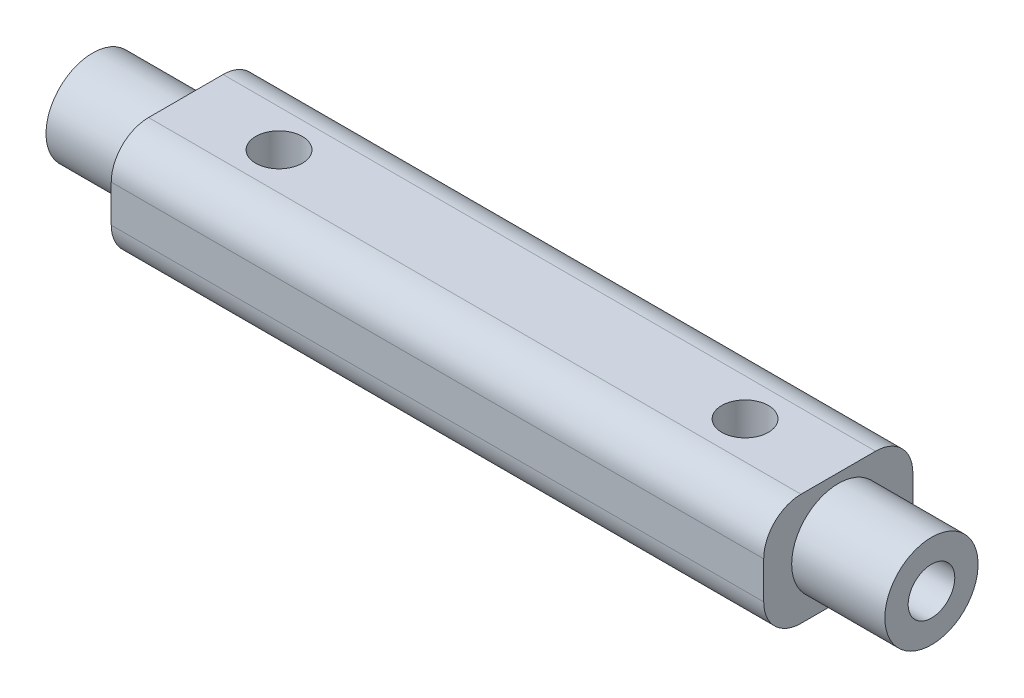
from build123d import *

# Parameters (mm, degrees)
SKETCH_1_W          = 8
SKETCH_1_H          = 6
EXTRUDE_1_DEPTH     = 17.5
SKETCH_2_R          = 2.5
EXTRUDE_2_DEPTH     = 22.5
FILLET_1_R          = 2
HOLE_WIZARD_M3_1_D  = 2.5
SKETCH_6_R          = 1
CUT_EXTRUDE_1_DEPTH = 24.627314701
HOLE_WIZARD_M3_2_D  = 2.5


with BuildPart() as part:
    # 草圖1 → 填料-伸長1 (new, symmetric)
    with BuildSketch(Plane(origin=(0, 0, 0), x_dir=(0, 0, -1), z_dir=(1, 0, 0))):
        Rectangle(SKETCH_1_W, SKETCH_1_H)
    extrude(amount=EXTRUDE_1_DEPTH, both=True)

    # 草圖2 → 填料-伸長2 (add, symmetric)
    with BuildSketch(Plane(origin=(0, 0, 0), x_dir=(0, 0, -1), z_dir=(1, 0, 0))):
        with Locations(Location((0, 0, 0), (0, 0, 180))):
            Circle(SKETCH_2_R)
    extrude(amount=EXTRUDE_2_DEPTH, both=True)

    # 圓角1
    fillet_1_edges = [part.edges().sort_by_distance(p)[0] for p in [
        (0, 3, 4),
        (0, 3, -4),
        (0, -3, -4),
        (0, -3, 4),
    ]]
    fillet(fillet_1_edges, radius=FILLET_1_R)

    # M3 螺紋孔1 (through all)
    with Locations(Plane(origin=(22.5, 0, 0), x_dir=(0, 0, -1), z_dir=(1, 0, 0))):
        with Locations((0, 0)):
            Hole(HOLE_WIZARD_M3_1_D / 2)

    # 草圖6 → 除料-伸長1 (cut, through all)
    with BuildSketch(Plane(origin=(0, 3, 0), x_dir=(1, 0, 0), z_dir=(0, 1, 0))):
        with Locations(Location((-12.5, 0, 0), (0, 0, 270))):
            Circle(SKETCH_6_R)
        with Locations(Location((12.5, 0, 0), (0, 0, 270))):
            Circle(SKETCH_6_R)
    extrude(amount=-CUT_EXTRUDE_1_DEPTH, mode=Mode.SUBTRACT)

    # M3 螺紋孔2 (through all)
    with Locations(Plane(origin=(-12.5, 3, 0), x_dir=(0, 0, 1), z_dir=(0, 1, 0))):
        with Locations((0, 0), (0, 25)):
            Hole(HOLE_WIZARD_M3_2_D / 2)


solid = part.part
